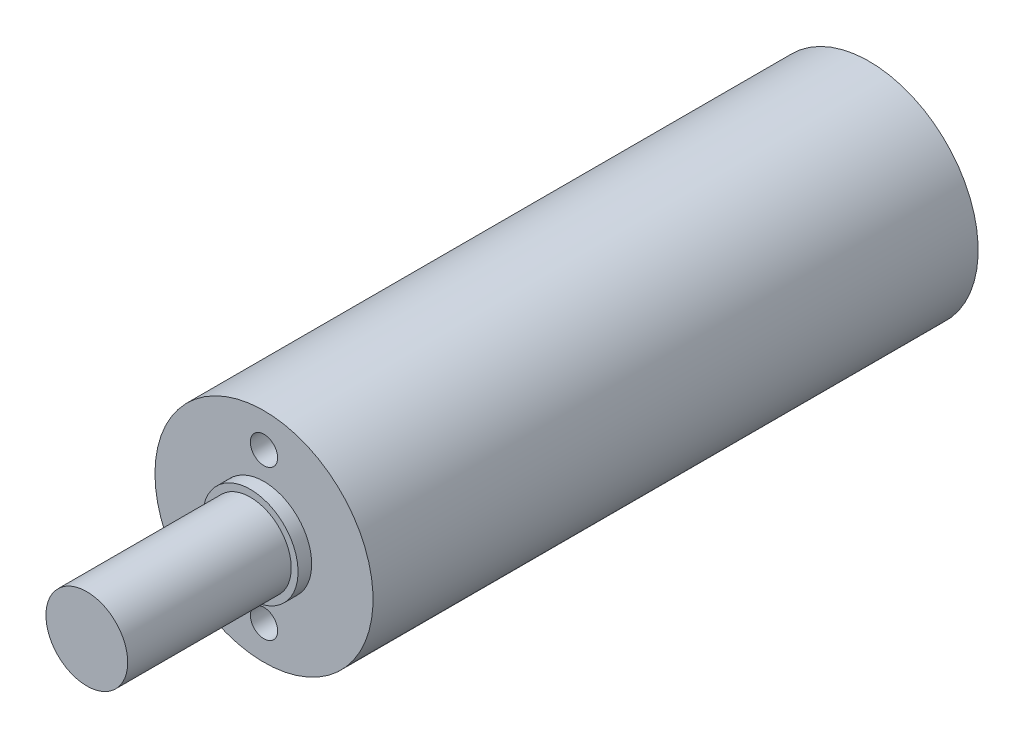
from build123d import *

# Parameters (mm, degrees)
SKETCH1_R           = 3
BOSS_EXTRUDE1_DEPTH = 12
SKETCH2_R           = 3.5
BOSS_EXTRUDE2_DEPTH = 1
SKETCH3_R           = 8
BOSS_EXTRUDE3_DEPTH = 44.4
SKETCH4_R           = 1
CUT_EXTRUDE1_DEPTH  = 3


with BuildPart() as part:
    # Sketch1 → Boss-Extrude1 (new body)
    with BuildSketch(Plane.XY):
        Circle(SKETCH1_R)
    extrude(amount=BOSS_EXTRUDE1_DEPTH)

    # Sketch2 → Boss-Extrude2 (add)
    with BuildSketch(Plane(origin=(0, 0, 0), x_dir=(-1, 0, 0), z_dir=(0, 0, -1))):
        Circle(SKETCH2_R)
    extrude(amount=BOSS_EXTRUDE2_DEPTH)

    # Sketch3 → Boss-Extrude3 (add)
    with BuildSketch(Plane(origin=(0, 0, -1), x_dir=(-1, 0, 0), z_dir=(0, 0, -1))):
        Circle(SKETCH3_R)
    extrude(amount=BOSS_EXTRUDE3_DEPTH)

    # Sketch4 → Cut-Extrude1 (cut)
    with BuildSketch(Plane.XY.offset(-1)):
        with Locations((0, 5.5)):
            Circle(SKETCH4_R)
        with Locations((0, -5.5)):
            Circle(SKETCH4_R)
    extrude(amount=-CUT_EXTRUDE1_DEPTH, mode=Mode.SUBTRACT)


solid = part.part
